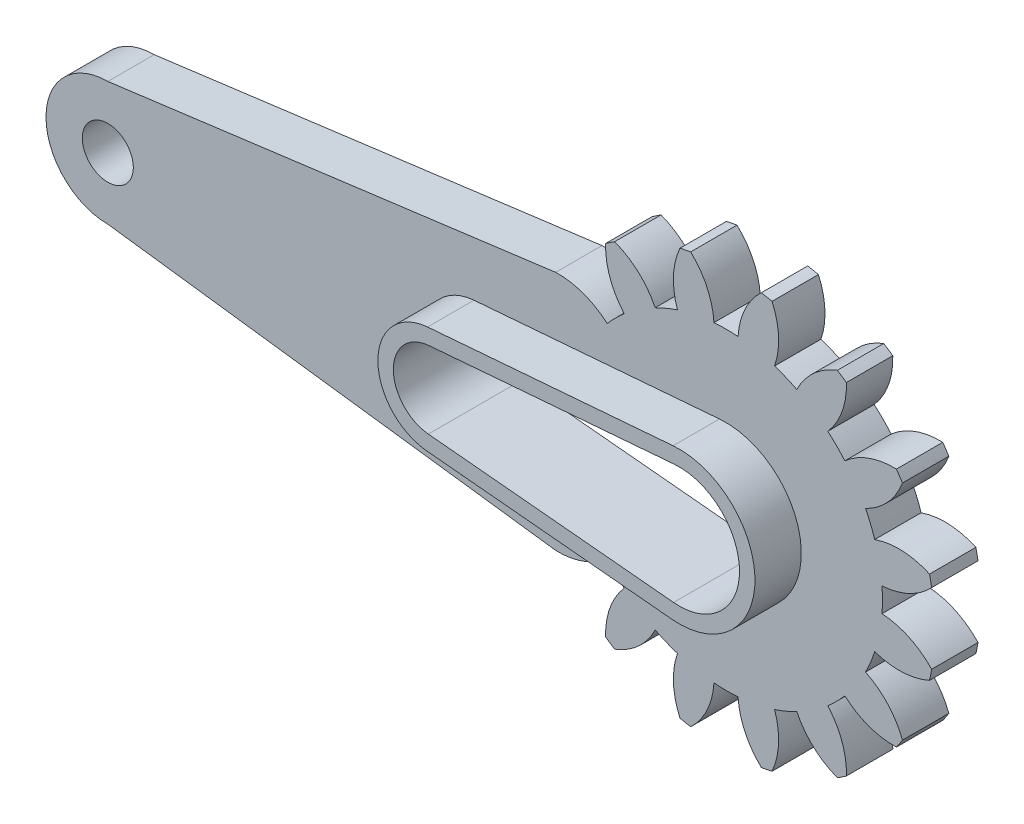
from build123d import *

# Parameters (mm, degrees)
SKETCH1_R           = 1.65
BOSS_EXTRUDE1_DEPTH = 3
BOSS_EXTRUDE2_START = 3
BOSS_EXTRUDE2_DEPTH = 3


with BuildPart() as part:
    # Sketch1 → Boss-Extrude1 (new body)
    with BuildSketch(Plane.XY):
        with BuildLine():
            ThreePointArc((-5.102248015, 11.557418974), (-6.655042336, 12.47922503), (-8.43855136, 12.762053897))
            Line((-8.43855136, 12.762053897), (-37.413359367, 8.97134523))
            ThreePointArc((-37.413359367, 8.97134523), (-41.413359367, 4.97134523), (-37.413359367, 0.97134523))
            Line((-37.413359367, 0.97134523), (-8.43855136, -2.819363436))
            ThreePointArc((-8.43855136, -2.819363436), (-6.655042336, -2.53653457), (-5.102248015, -1.614728513))
            ThreePointArc((-5.102248015, -1.614728513), (-4.57210842, -2.187403822), (-3.999433111, -2.717543418))
            ThreePointArc((-3.999433111, -2.717543418), (-4.921239167, -4.270337738), (-5.204068034, -6.053846762))
            ThreePointArc((-5.204068034, -6.053846762), (-4.913557513, -6.253494536), (-4.617933458, -6.445489365))
            ThreePointArc((-4.617933458, -6.445489365), (-3.078419896, -5.501670209), (-1.996584911, -4.0558038))
            ThreePointArc((-1.996584911, -4.0558038), (-1.287646436, -4.382011157), (-0.5556878, -4.652642925))
            ThreePointArc((-0.5556878, -4.652642925), (-0.813096888, -6.439997722), (-0.391877334, -8.195979127))
            ThreePointArc((-0.391877334, -8.195979127), (-0.047078714, -8.269256055), (0.299515539, -8.33350572))
            ThreePointArc((0.299515539, -8.33350572), (1.360656655, -6.872384185), (1.806832736, -5.122577478))
            ThreePointArc((1.806832736, -5.122577478), (2.586640633, -5.15265477), (3.36644853, -5.122577478))
            ThreePointArc((3.36644853, -5.122577478), (3.81262461, -6.872384185), (4.873765726, -8.33350572))
            ThreePointArc((4.873765726, -8.33350572), (5.22035998, -8.269256055), (5.565158599, -8.195979127))
            ThreePointArc((5.565158599, -8.195979127), (5.986378153, -6.439997722), (5.728969065, -4.652642925))
            ThreePointArc((5.728969065, -4.652642925), (6.460927702, -4.382011157), (7.169866176, -4.0558038))
            ThreePointArc((7.169866176, -4.0558038), (8.251701162, -5.501670209), (9.791214724, -6.445489365))
            ThreePointArc((9.791214724, -6.445489365), (10.086838779, -6.253494536), (10.377349299, -6.053846762))
            ThreePointArc((10.377349299, -6.053846762), (10.094520433, -4.270337738), (9.172714377, -2.717543418))
            ThreePointArc((9.172714377, -2.717543418), (9.745389686, -2.187403822), (10.275529281, -1.614728513))
            ThreePointArc((10.275529281, -1.614728513), (11.828323601, -2.53653457), (13.611832625, -2.819363436))
            ThreePointArc((13.611832625, -2.819363436), (13.811480399, -2.528852915), (14.003475228, -2.233228861))
            ThreePointArc((14.003475228, -2.233228861), (13.059656072, -0.693715298), (11.613789663, 0.388119687))
            ThreePointArc((11.613789663, 0.388119687), (11.93999702, 1.097058161), (12.210628788, 1.829016798))
            ThreePointArc((12.210628788, 1.829016798), (13.997983585, 1.57160771), (15.75396499, 1.992827264))
            ThreePointArc((15.75396499, 1.992827264), (15.827241918, 2.337625883), (15.891491583, 2.684220137))
            ThreePointArc((15.891491583, 2.684220137), (14.430370048, 3.745361253), (12.680563341, 4.191537333))
            ThreePointArc((12.680563341, 4.191537333), (12.710640633, 4.97134523), (12.680563341, 5.751153127))
            ThreePointArc((12.680563341, 5.751153127), (14.430370048, 6.197329208), (15.891491583, 7.258470324))
            ThreePointArc((15.891491583, 7.258470324), (15.827241918, 7.605064578), (15.75396499, 7.949863197))
            ThreePointArc((15.75396499, 7.949863197), (13.997983585, 8.371082751), (12.210628788, 8.113673663))
            ThreePointArc((12.210628788, 8.113673663), (11.93999702, 8.8456323), (11.613789663, 9.554570774))
            ThreePointArc((11.613789663, 9.554570774), (13.059656072, 10.636405759), (14.003475228, 12.175919321))
            ThreePointArc((14.003475228, 12.175919321), (13.811480399, 12.471543376), (13.611832625, 12.762053897))
            ThreePointArc((13.611832625, 12.762053897), (11.828323601, 12.47922503), (10.275529281, 11.557418974))
            ThreePointArc((10.275529281, 11.557418974), (9.745389686, 12.130094283), (9.172714377, 12.660233878))
            ThreePointArc((9.172714377, 12.660233878), (10.094520433, 14.213028199), (10.377349299, 15.996537223))
            ThreePointArc((10.377349299, 15.996537223), (10.086838779, 16.196184996), (9.791214724, 16.388179825))
            ThreePointArc((9.791214724, 16.388179825), (8.251701162, 15.444360669), (7.169866176, 13.998494261))
            ThreePointArc((7.169866176, 13.998494261), (6.460927702, 14.324701618), (5.728969065, 14.595333386))
            ThreePointArc((5.728969065, 14.595333386), (5.986378153, 16.382688183), (5.565158599, 18.138669587))
            ThreePointArc((5.565158599, 18.138669587), (5.22035998, 18.211946516), (4.873765726, 18.276196181))
            ThreePointArc((4.873765726, 18.276196181), (3.81262461, 16.815074646), (3.36644853, 15.065267939))
            ThreePointArc((3.36644853, 15.065267939), (2.586640633, 15.09534523), (1.806832736, 15.065267939))
            ThreePointArc((1.806832736, 15.065267939), (1.360656655, 16.815074646), (0.299515539, 18.276196181))
            ThreePointArc((0.299515539, 18.276196181), (-0.047078714, 18.211946516), (-0.391877334, 18.138669587))
            ThreePointArc((-0.391877334, 18.138669587), (-0.813096888, 16.382688183), (-0.5556878, 14.595333386))
            ThreePointArc((-0.5556878, 14.595333386), (-1.287646436, 14.324701618), (-1.996584911, 13.998494261))
            ThreePointArc((-1.996584911, 13.998494261), (-3.078419896, 15.444360669), (-4.617933458, 16.388179825))
            ThreePointArc((-4.617933458, 16.388179825), (-4.913557513, 16.196184996), (-5.204068034, 15.996537223))
            ThreePointArc((-5.204068034, 15.996537223), (-4.921239167, 14.213028199), (-3.999433111, 12.660233878))
            ThreePointArc((-3.999433111, 12.660233878), (-4.57210842, 12.130094283), (-5.102248015, 11.557418974))
        make_face()
        with BuildLine():
            ThreePointArc((2.244369697, 8.847463799), (6.459336179, 4.933922237), (2.191995363, 1.077557063))
            Line((2.191995363, 1.077557063), (-13.675743419, 2.579178177))
            ThreePointArc((-13.675743419, 2.579178177), (-15.940154949, 5.084909691), (-13.642170127, 7.559887623))
            Line((-13.642170127, 7.559887623), (2.244369697, 8.847463799))
        make_face(mode=Mode.SUBTRACT)
        with Locations((-37.413359367, 4.97134523)):
            Circle(SKETCH1_R, mode=Mode.SUBTRACT)
    extrude(amount=-BOSS_EXTRUDE1_DEPTH)

    # Sketch1<3> → Boss-Extrude2 (add)
    with BuildSketch(Plane.XY.offset(BOSS_EXTRUDE2_START)):
        with BuildLine():
            Line((2.163586343, 9.844195483), (-13.722953481, 8.556619307))
            ThreePointArc((-13.722953481, 8.556619307), (-16.940132231, 5.091650203), (-13.769956089, 1.583626083))
            Line((-13.769956089, 1.583626083), (2.097782692, 0.082004969))
            ThreePointArc((2.097782692, 0.082004969), (7.459313462, 4.927181726), (2.163586343, 9.844195483))
        make_face()
        with BuildLine():
            ThreePointArc((2.244369697, 8.847463799), (6.459336179, 4.933922237), (2.191995363, 1.077557063))
            Line((2.191995363, 1.077557063), (-13.675743419, 2.579178177))
            ThreePointArc((-13.675743419, 2.579178177), (-15.940154949, 5.084909691), (-13.642170127, 7.559887623))
            Line((-13.642170127, 7.559887623), (2.244369697, 8.847463799))
        make_face(mode=Mode.SUBTRACT)
    extrude(amount=-BOSS_EXTRUDE2_DEPTH)


solid = part.part
